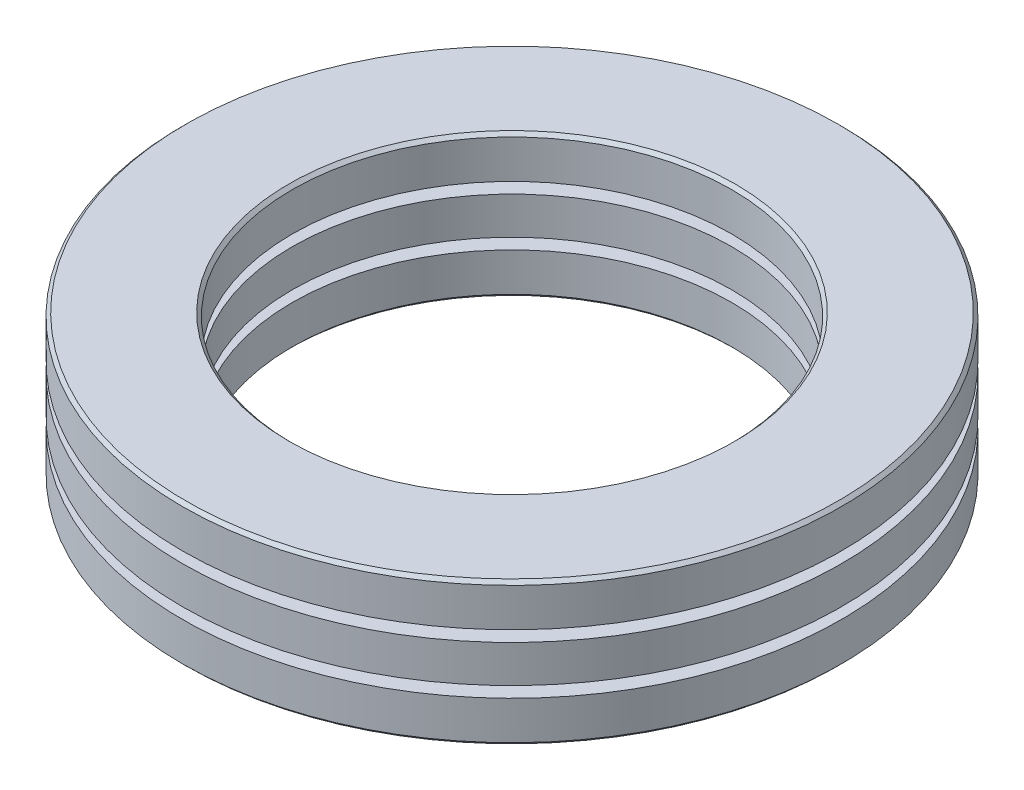
from build123d import *

# Parameters (mm, degrees)
SKETCH1_R           = 30
SKETCH1_R_2         = 20
BOSS_EXTRUDE1_DEPTH = 3.8
SKETCH2_R           = 30
SKETCH2_R_2         = 20
BOSS_EXTRUDE2_DEPTH = 3.4
SKETCH3_R           = 30
SKETCH3_R_2         = 20
BOSS_EXTRUDE3_DEPTH = 3.8
CIRPATTERN1_COUNT   = 18
CIRPATTERN4_COUNT   = 18
CHAMFER1_SIZE       = 0.3
CHAMFER2_SIZE       = 0.3


with BuildPart() as part:
    # Sketch1 → Boss-Extrude1 (new body)
    with BuildSketch(Plane(origin=(0, 0, 0), x_dir=(1, 0, 0), z_dir=(0, 1, 0))):
        with Locations(Location((0, 0, 0), (0, 0, 90))):
            Circle(SKETCH1_R)
        with Locations(Location((0, 0, 0), (0, 0, 90))):
            Circle(SKETCH1_R_2, mode=Mode.SUBTRACT)
    extrude(amount=BOSS_EXTRUDE1_DEPTH)

    # Chamfer1
    chamfer1_edges = [part.edges().sort_by_distance(p)[0] for p in [
        (0, 0, 30),
        (0, 0, 20),
    ]]
    chamfer(chamfer1_edges, length=CHAMFER1_SIZE)


with BuildPart() as body_2:
    # Sketch2 → Boss-Extrude2 (new body)
    with BuildSketch(Plane(origin=(0, 4.8, 0), x_dir=(1, 0, 0), z_dir=(0, 1, 0))):
        with Locations(Location((0, 0, 0), (0, 0, 270))):
            Circle(SKETCH2_R)
        with Locations(Location((0, 0, 0), (0, 0, 270))):
            Circle(SKETCH2_R_2, mode=Mode.SUBTRACT)
    extrude(amount=BOSS_EXTRUDE2_DEPTH)

    # Sketch4 → Cut-Revolve2 (revolve, cut)
    with BuildSketch(Plane.XY):
        with BuildLine():
            Line((-27.7, 6.5), (-22.3, 6.5))
            ThreePointArc((-22.3, 6.5), (-25, 9.2), (-27.7, 6.5))
        make_face()
    cut_revolve2 = revolve(axis=Axis((-27.7, 6.5, 0), (1, 0, 0)), mode=Mode.SUBTRACT)

    # CirPattern1: Cut-Revolve2 ×18 about axis
    cirpattern1_axis = Axis((0, 0, 0), (0, 1, 0))
    for i in range(1, CIRPATTERN1_COUNT):
        add(cut_revolve2.rotate(cirpattern1_axis, i * 360 / CIRPATTERN1_COUNT), mode=Mode.SUBTRACT)


with BuildPart() as body_3:
    # Sketch3 → Boss-Extrude3 (new body)
    with BuildSketch(Plane(origin=(0, 13, 0), x_dir=(-1, 0, 0), z_dir=(0, -1, 0))):
        with Locations(Location((0, 0, 0), (0, 0, 270))):
            Circle(SKETCH3_R)
        with Locations(Location((0, 0, 0), (0, 0, 270))):
            Circle(SKETCH3_R_2, mode=Mode.SUBTRACT)
    extrude(amount=BOSS_EXTRUDE3_DEPTH)

    # Chamfer2
    chamfer2_edges = [body_3.edges().sort_by_distance(p)[0] for p in [
        (0, 13, -30),
        (0, 13, -20),
    ]]
    chamfer(chamfer2_edges, length=CHAMFER2_SIZE)


with BuildPart() as body_4:
    # Sketch4<3> → Revolve1 (revolve)
    with BuildSketch(Plane.XY):
        with BuildLine():
            Line((-27.7, 6.5), (-22.3, 6.5))
            ThreePointArc((-22.3, 6.5), (-25, 9.2), (-27.7, 6.5))
        make_face()
    revolve(axis=Axis((-27.7, 6.5, 0), (1, 0, 0)))


with BuildPart() as cirpattern4_1:
    # CirPattern4: pattern copy
    add(body_4.part.rotate(Axis((0, 0, 0), (0, 1, 0)), 1 * 360 / CIRPATTERN4_COUNT))


with BuildPart() as cirpattern4_2:
    # CirPattern4: pattern copy
    add(body_4.part.rotate(Axis((0, 0, 0), (0, 1, 0)), 2 * 360 / CIRPATTERN4_COUNT))


with BuildPart() as cirpattern4_3:
    # CirPattern4: pattern copy
    add(body_4.part.rotate(Axis((0, 0, 0), (0, 1, 0)), 3 * 360 / CIRPATTERN4_COUNT))


with BuildPart() as cirpattern4_4:
    # CirPattern4: pattern copy
    add(body_4.part.rotate(Axis((0, 0, 0), (0, 1, 0)), 4 * 360 / CIRPATTERN4_COUNT))


with BuildPart() as cirpattern4_5:
    # CirPattern4: pattern copy
    add(body_4.part.rotate(Axis((0, 0, 0), (0, 1, 0)), 5 * 360 / CIRPATTERN4_COUNT))


with BuildPart() as cirpattern4_6:
    # CirPattern4: pattern copy
    add(body_4.part.rotate(Axis((0, 0, 0), (0, 1, 0)), 6 * 360 / CIRPATTERN4_COUNT))


with BuildPart() as cirpattern4_7:
    # CirPattern4: pattern copy
    add(body_4.part.rotate(Axis((0, 0, 0), (0, 1, 0)), 7 * 360 / CIRPATTERN4_COUNT))


with BuildPart() as cirpattern4_8:
    # CirPattern4: pattern copy
    add(body_4.part.rotate(Axis((0, 0, 0), (0, 1, 0)), 8 * 360 / CIRPATTERN4_COUNT))


with BuildPart() as cirpattern4_9:
    # CirPattern4: pattern copy
    add(body_4.part.rotate(Axis((0, 0, 0), (0, 1, 0)), 9 * 360 / CIRPATTERN4_COUNT))


with BuildPart() as cirpattern4_10:
    # CirPattern4: pattern copy
    add(body_4.part.rotate(Axis((0, 0, 0), (0, 1, 0)), 10 * 360 / CIRPATTERN4_COUNT))


with BuildPart() as cirpattern4_11:
    # CirPattern4: pattern copy
    add(body_4.part.rotate(Axis((0, 0, 0), (0, 1, 0)), 11 * 360 / CIRPATTERN4_COUNT))


with BuildPart() as cirpattern4_12:
    # CirPattern4: pattern copy
    add(body_4.part.rotate(Axis((0, 0, 0), (0, 1, 0)), 12 * 360 / CIRPATTERN4_COUNT))


with BuildPart() as cirpattern4_13:
    # CirPattern4: pattern copy
    add(body_4.part.rotate(Axis((0, 0, 0), (0, 1, 0)), 13 * 360 / CIRPATTERN4_COUNT))


with BuildPart() as cirpattern4_14:
    # CirPattern4: pattern copy
    add(body_4.part.rotate(Axis((0, 0, 0), (0, 1, 0)), 14 * 360 / CIRPATTERN4_COUNT))


with BuildPart() as cirpattern4_15:
    # CirPattern4: pattern copy
    add(body_4.part.rotate(Axis((0, 0, 0), (0, 1, 0)), 15 * 360 / CIRPATTERN4_COUNT))


with BuildPart() as cirpattern4_16:
    # CirPattern4: pattern copy
    add(body_4.part.rotate(Axis((0, 0, 0), (0, 1, 0)), 16 * 360 / CIRPATTERN4_COUNT))


with BuildPart() as cirpattern4_17:
    # CirPattern4: pattern copy
    add(body_4.part.rotate(Axis((0, 0, 0), (0, 1, 0)), 17 * 360 / CIRPATTERN4_COUNT))


solid = Compound([part.part, body_2.part, body_3.part, body_4.part, cirpattern4_1.part, cirpattern4_2.part, cirpattern4_3.part, cirpattern4_4.part, cirpattern4_5.part, cirpattern4_6.part, cirpattern4_7.part, cirpattern4_8.part, cirpattern4_9.part, cirpattern4_10.part, cirpattern4_11.part, cirpattern4_12.part, cirpattern4_13.part, cirpattern4_14.part, cirpattern4_15.part, cirpattern4_16.part, cirpattern4_17.part])
